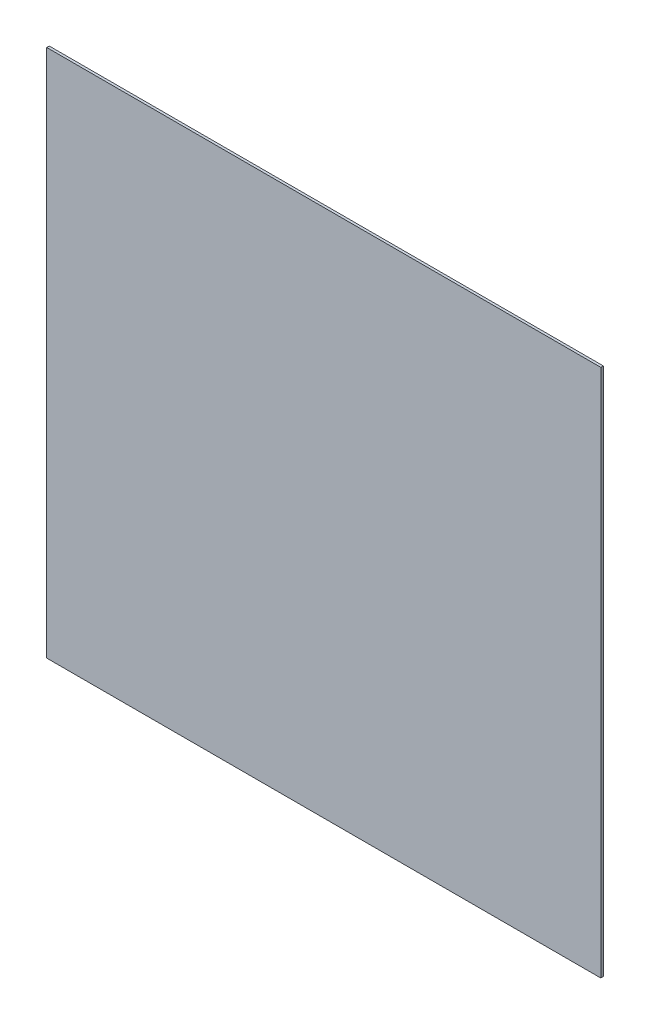
from build123d import *

# Parameters (mm, degrees)
ESQUISSE1_W        = 440
ESQUISSE1_H        = 420
BOSS_EXTRU_1_DEPTH = 2


with BuildPart() as part:
    # Esquisse1 → Boss.-Extru.1 (new body)
    with BuildSketch(Plane.XY):
        with Locations((0, 49.117470254)):
            Rectangle(ESQUISSE1_W, ESQUISSE1_H)
    extrude(amount=BOSS_EXTRU_1_DEPTH)


solid = part.part
